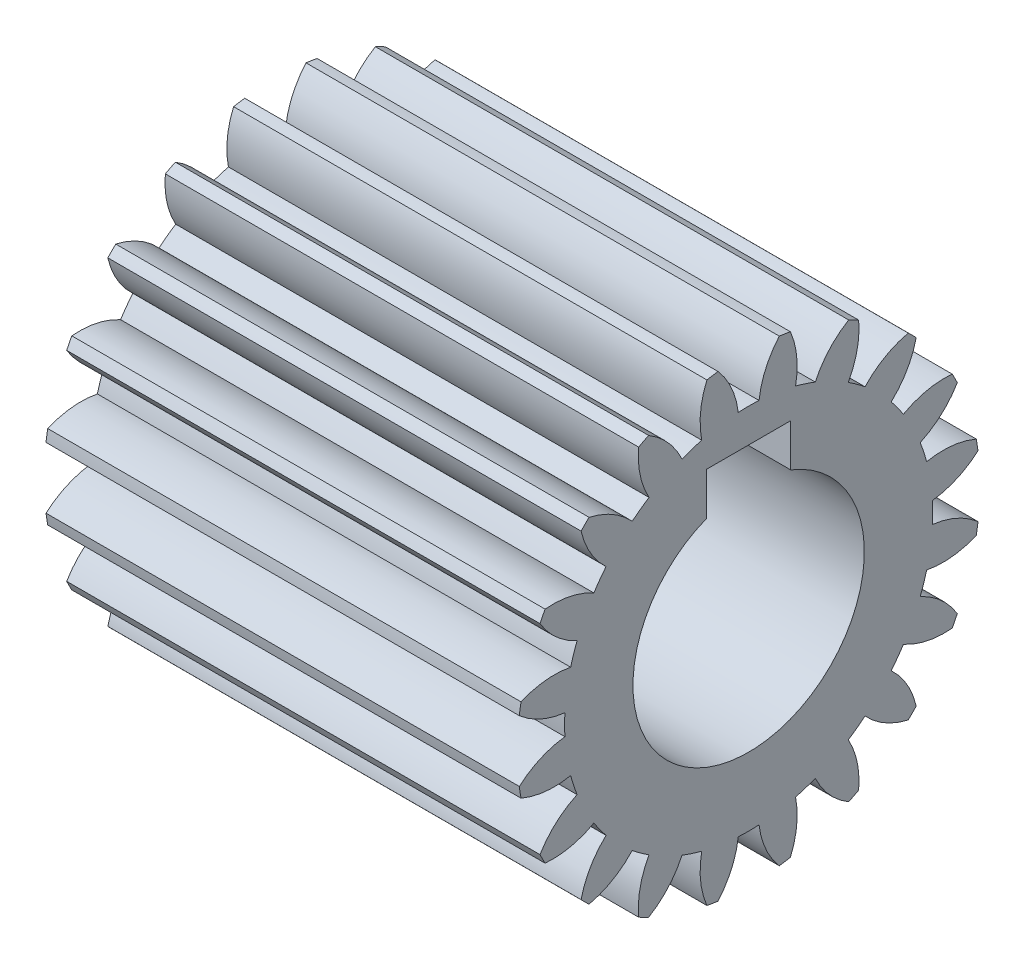
from build123d import *

# Parameters (mm, degrees)
BASPROSKE_W     = 45
BASPROSKE_H     = 22
TOOTHCUT_DEPTH  = 55.708317466
TEETHCUTS_COUNT = 20
TEETHCUTS_ANGLE = 342
BORSKE_R        = 11
BORE_DEPTH      = 50.0000508
KEYSKE_W        = 8
KEYSKE_H        = 14.3
KEYWAY_DEPTH    = 50.0000508


with BuildPart() as part:
    # BasProSke → Base-Revolve (revolve)
    with BuildSketch(Plane(origin=(0, 0, 0), x_dir=(1, 0, 0), z_dir=(0, 1, 0)), mode=Mode.PRIVATE) as base_revolve_sk:
        with Locations((22.5, 11)):
            Rectangle(BASPROSKE_W, BASPROSKE_H)
    revolve(base_revolve_sk.sketch.rotate(Axis((-10, 0, 0), (1, 0, 0)), 180), axis=Axis((-10, 0, 0), (1, 0, 0)))

    # TooCutSke → ToothCut (cut, through all)
    with BuildSketch(Plane(origin=(0, 0, 0), x_dir=(0, 0, -1), z_dir=(1, 0, 0))):
        with BuildLine():
            ThreePointArc((0.986171591, 17.471189616), (0, 17.499), (-0.986171591, 17.471189616))
            ThreePointArc((-0.986171591, 17.471189616), (-1.626916196, 19.798789858), (-2.932850173, 21.829260982))
            ThreePointArc((-2.932850173, 21.829260982), (0, 22.0254), (2.932850173, 21.829260982))
            ThreePointArc((2.932850173, 21.829260982), (1.626916196, 19.798789858), (0.986171591, 17.471189616))
        make_face()
    toothcut = extrude(amount=TOOTHCUT_DEPTH, mode=Mode.SUBTRACT)

    # TeethCuts: ToothCut ×20 about axis
    teethcuts_axis = Axis((-10, 0, 0), (1, 0, 0))
    for i in range(1, TEETHCUTS_COUNT):
        add(toothcut.rotate(teethcuts_axis, i * TEETHCUTS_ANGLE / (TEETHCUTS_COUNT - 1)), mode=Mode.SUBTRACT)

    # BorSke → Bore (cut, symmetric)
    with BuildSketch(Plane(origin=(0, 0, 0), x_dir=(0, 0, -1), z_dir=(1, 0, 0))):
        with Locations(Location((0, 0, 0), (0, 0, 180))):
            Circle(BORSKE_R)
    extrude(amount=BORE_DEPTH, both=True, mode=Mode.SUBTRACT)

    # KeySke → Keyway (cut, symmetric)
    with BuildSketch(Plane(origin=(0, 0, 0), x_dir=(0, 0, -1), z_dir=(1, 0, 0))):
        with Locations((0, 7.15)):
            Rectangle(KEYSKE_W, KEYSKE_H)
    extrude(amount=KEYWAY_DEPTH, both=True, mode=Mode.SUBTRACT)


solid = part.part
